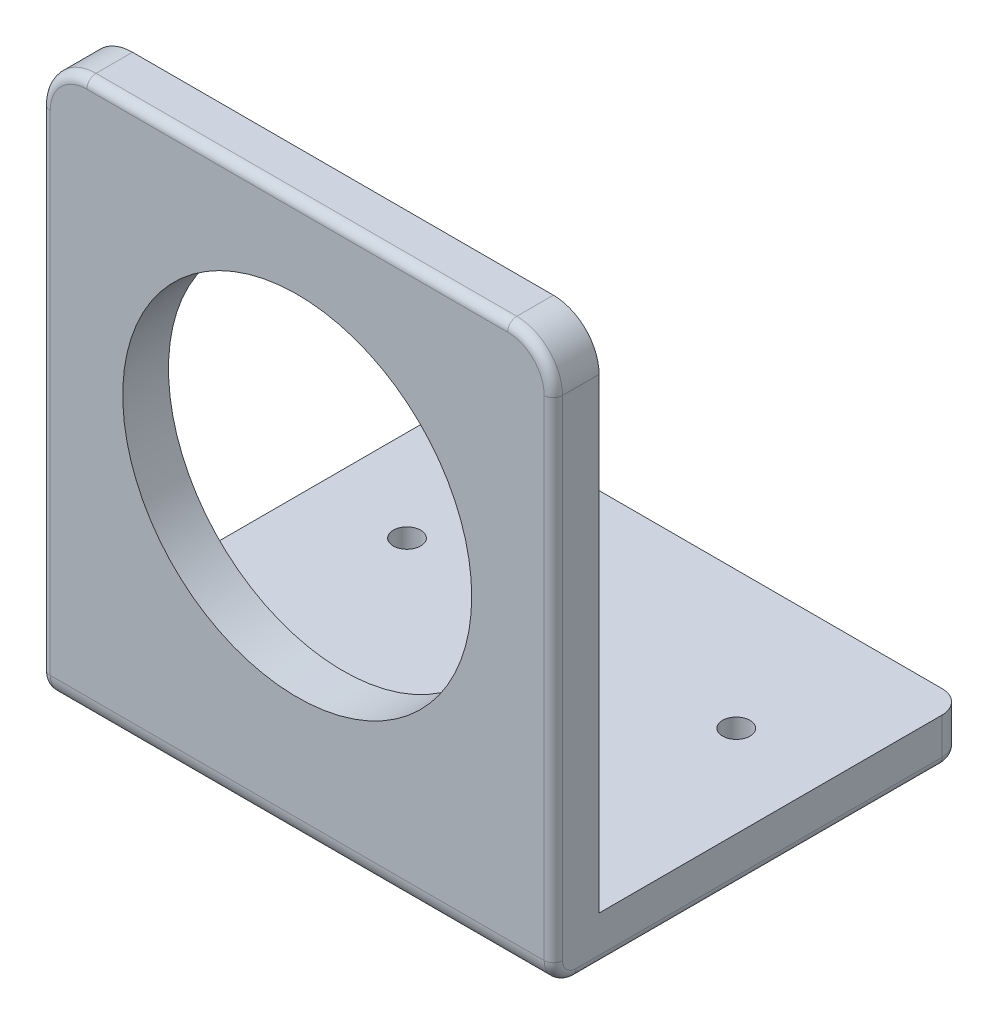
from build123d import *

# Parameters (mm, degrees)
ESQUISSE1_R             = 19.075
BOSS_EXTRU_2_DEPTH      = 5
ESQUISSE2_W             = 56
ESQUISSE2_H             = 5
BOSS_EXTRU_3_DEPTH      = 5
ESQUISSE3_W             = 56
ESQUISSE3_H             = 5
BOSS_EXTRU_4_DEPTH      = 50
CONG_1_R                = 2.5
ESQUISSE5_R             = 1.5
ENL_V_MAT_EXTRU_2_DEPTH = 5
ESQUISSE6_W             = 56
ESQUISSE6_H             = 5
ENL_V_MAT_EXTRU_3_DEPTH = 10
CONG_2_R                = 2.5
CONG_3_R                = 1


with BuildPart() as part:
    # Esquisse1 → Boss.-Extru.2 (new body)
    with BuildSketch(Plane.XY):
        with BuildLine():
            Line((-23, 28), (23, 28))
            ThreePointArc((23, 28), (26.535533906, 26.535533906), (28, 23))
            Line((28, 23), (28, -28))
            Line((28, -28), (-28, -28))
            Line((-28, -28), (-28, 23))
            ThreePointArc((-28, 23), (-26.535533906, 26.535533906), (-23, 28))
        make_face()
        Circle(ESQUISSE1_R, mode=Mode.SUBTRACT)
    extrude(amount=BOSS_EXTRU_2_DEPTH)

    # Esquisse2 → Boss.-Extru.3 (add)
    with BuildSketch(Plane.XZ.offset(28)):
        with Locations((0, 2.5)):
            Rectangle(ESQUISSE2_W, ESQUISSE2_H)
    extrude(amount=BOSS_EXTRU_3_DEPTH)

    # Esquisse3 → Boss.-Extru.4 (add)
    with BuildSketch(Plane(origin=(0, 0, 0), x_dir=(-1, 0, 0), z_dir=(0, 0, -1))):
        with Locations((0, -30.5)):
            Rectangle(ESQUISSE3_W, ESQUISSE3_H)
    extrude(amount=BOSS_EXTRU_4_DEPTH)

    # Congé1
    cong_1_edges = [part.edges().sort_by_distance(p)[0] for p in [
        (0, -33, 5),
    ]]
    fillet(cong_1_edges, radius=CONG_1_R)

    # Esquisse5 → Enlèv. mat.-Extru.2 (cut)
    with BuildSketch(Plane(origin=(0, -28, 0), x_dir=(1, 0, 0), z_dir=(0, 1, 0))):
        with Locations(Location((-18, 25, 0), (0, 0, 270))):
            Circle(ESQUISSE5_R)
        with Locations(Location((18, 25, 0), (0, 0, 90))):
            Circle(ESQUISSE5_R)
    extrude(amount=-ENL_V_MAT_EXTRU_2_DEPTH, mode=Mode.SUBTRACT)

    # Esquisse6 → Enlèv. mat.-Extru.3 (cut)
    with BuildSketch(Plane(origin=(0, 0, -50), x_dir=(-1, 0, 0), z_dir=(0, 0, -1))):
        with Locations((0, -30.5)):
            Rectangle(ESQUISSE6_W, ESQUISSE6_H)
    extrude(amount=-ENL_V_MAT_EXTRU_3_DEPTH, mode=Mode.SUBTRACT)

    # Congé2
    cong_2_edges = [part.edges().sort_by_distance(p)[0] for p in [
        (28, -30.5, -40),
        (-28, -30.5, -40),
    ]]
    fillet(cong_2_edges, radius=CONG_2_R)

    # Congé3
    cong_3_edges = [part.edges().sort_by_distance(p)[0] for p in [
        (0, 28, 5),
        (-26.535533906, 26.535533906, 5),
        (-28, -3.75, 5),
        (-28, -33, -17.5),
        (-28, -32.267766953, 4.267766953),
        (28, -3.75, 5),
        (28, -32.267766953, 4.267766953),
        (0, -33, -40),
        (26.535533906, 26.535533906, 5),
        (28, -33, -17.5),
        (27.267766953, -33, -39.267766953),
        (-27.267766953, -33, -39.267766953),
    ]]
    fillet(cong_3_edges, radius=CONG_3_R)


solid = part.part
